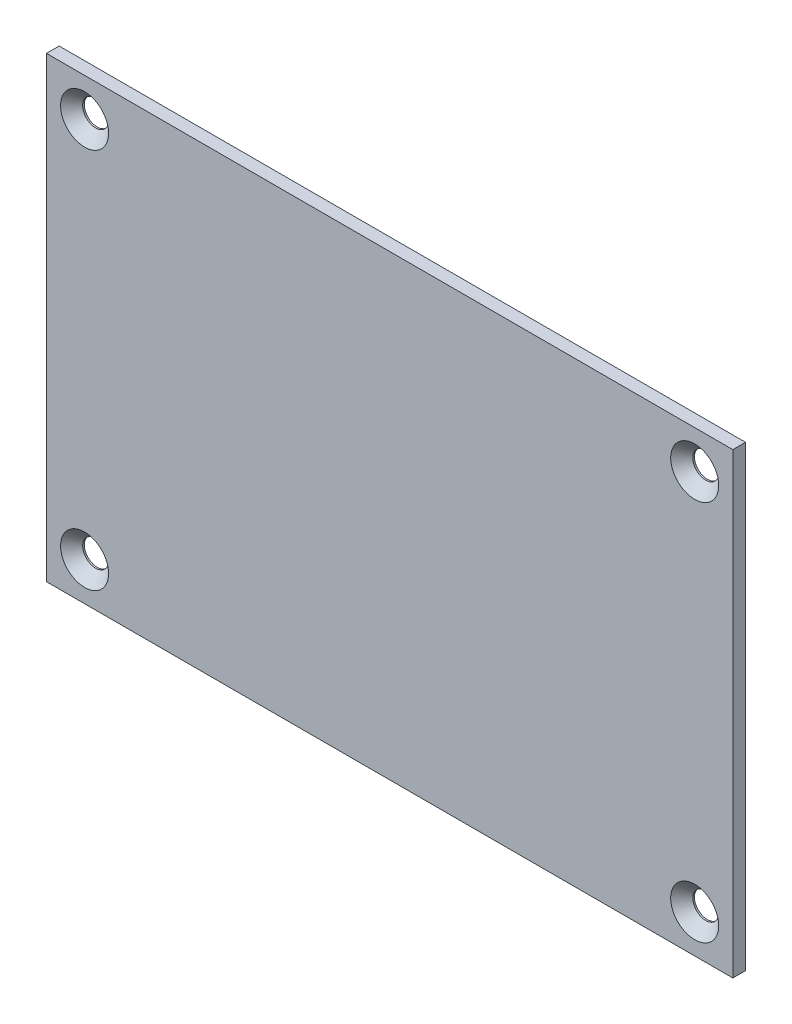
from build123d import *

# Parameters (mm, degrees)
SKETCH1_W                                           = 90
SKETCH1_H                                           = 60
BOSS_EXTRUDE1_DEPTH                                 = 1.666
CSK_FOR_M3_COUNTERSUNK_FLAT_HEAD_SCREW1_D           = 3.4
CSK_FOR_M3_COUNTERSUNK_FLAT_HEAD_SCREW1_DEPTH       = 30
CSK_FOR_M3_COUNTERSUNK_FLAT_HEAD_SCREW1_CSINK_D     = 6.3
CSK_FOR_M3_COUNTERSUNK_FLAT_HEAD_SCREW1_CSINK_ANGLE = 90
CSK_FOR_M3_COUNTERSUNK_FLAT_HEAD_SCREW1_TIP         = 1.021463052


with BuildPart() as part:
    # Sketch1 → Boss-Extrude1 (new body)
    with BuildSketch(Plane.XY):
        with Locations((45, 30)):
            Rectangle(SKETCH1_W, SKETCH1_H)
    extrude(amount=BOSS_EXTRUDE1_DEPTH)

    # CSK for M3 Countersunk Flat Head Screw1
    with Locations(Plane.XY.offset(1.666)):
        with Locations((5, 55), (5, 5), (85, 5), (85, 55)):
            CounterSinkHole(CSK_FOR_M3_COUNTERSUNK_FLAT_HEAD_SCREW1_D / 2, CSK_FOR_M3_COUNTERSUNK_FLAT_HEAD_SCREW1_CSINK_D / 2, depth=CSK_FOR_M3_COUNTERSUNK_FLAT_HEAD_SCREW1_DEPTH, counter_sink_angle=CSK_FOR_M3_COUNTERSUNK_FLAT_HEAD_SCREW1_CSINK_ANGLE)
            with Locations((0, 0, -(CSK_FOR_M3_COUNTERSUNK_FLAT_HEAD_SCREW1_DEPTH + CSK_FOR_M3_COUNTERSUNK_FLAT_HEAD_SCREW1_TIP / 2))):  # 118° drill point
                Cone(0, CSK_FOR_M3_COUNTERSUNK_FLAT_HEAD_SCREW1_D / 2, CSK_FOR_M3_COUNTERSUNK_FLAT_HEAD_SCREW1_TIP, mode=Mode.SUBTRACT)


solid = part.part
